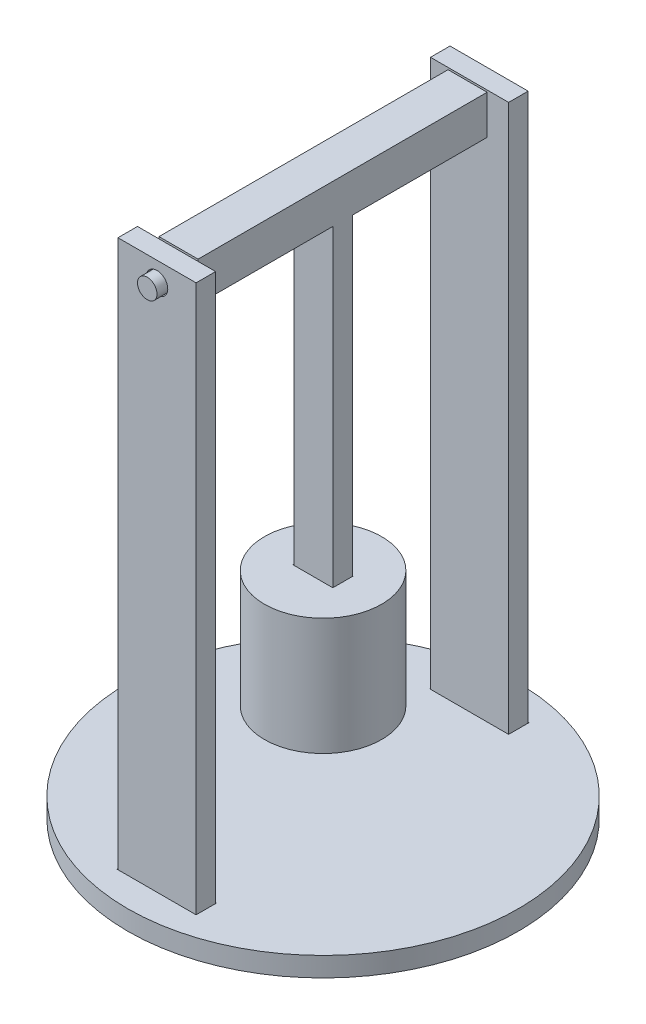
from build123d import *

# Parameters (mm, degrees)
SKETCH1_R               = 50
SKETCH1_W               = 20.2
SKETCH1_H               = 5.2
BOSS_EXTRUDE1_DEPTH     = 5
SKETCH2_W               = 20
SKETCH2_H               = 5
BOSS_EXTRUDE2_DEPTH     = 145
BOSS_EXTRUDE2_2_DEPTH   = 145
CUT_EXTRUDE1_DEPTH      = 162.322658049
CUT_EXTRUDE1_DEPTH_BACK = 162.322658049
SKETCH3_R               = 2.75
SKETCH4_R               = 2.5
BOSS_EXTRUDE3_DEPTH     = 45
SKETCH5_W               = 10
SKETCH5_H               = 10
SKETCH5_R               = 2.5
BOSS_EXTRUDE4_DEPTH     = 37
SKETCH10_W              = 10
SKETCH10_H              = 110
BOSS_EXTRUDE7_DEPTH     = 2.5
SKETCH11_R              = 15
SKETCH11_W              = 10.2
SKETCH11_H              = 5.2
BOSS_EXTRUDE8_DEPTH     = 15


with BuildPart() as part:
    # Sketch1 → Boss-Extrude1 (new body)
    with BuildSketch(Plane(origin=(0, 0, 0), x_dir=(1, 0, 0), z_dir=(0, 1, 0))):
        with Locations(Location((0, 0, 0), (0, 0, 270))):
            Circle(SKETCH1_R)
        with Locations((0, 40)):
            Rectangle(SKETCH1_W, SKETCH1_H, mode=Mode.SUBTRACT)
        with Locations((0, -40)):
            Rectangle(SKETCH1_W, SKETCH1_H, mode=Mode.SUBTRACT)
    extrude(amount=BOSS_EXTRUDE1_DEPTH)


with BuildPart() as body_2:
    # Sketch2 → Boss-Extrude2 (new body)
    with BuildSketch(Plane.XZ):
        with Locations((0, 40)):
            Rectangle(SKETCH2_W, SKETCH2_H)
    extrude(amount=-BOSS_EXTRUDE2_DEPTH)


with BuildPart() as body_3:
    # Sketch2 → Boss-Extrude2 2 (new body)
    with BuildSketch(Plane.XZ):
        with Locations((0, -40)):
            Rectangle(SKETCH2_W, SKETCH2_H)
    extrude(amount=-BOSS_EXTRUDE2_2_DEPTH)


with BuildPart() as cut_extrude1_tool:
    # Sketch3 → Cut-Extrude1 (new, two sides: drawn at the far end of the back side and taken through both)
    with BuildSketch(Plane.XY.offset(-CUT_EXTRUDE1_DEPTH_BACK)):
        with Locations((0, 140)):
            Circle(SKETCH3_R)
    extrude(amount=CUT_EXTRUDE1_DEPTH + CUT_EXTRUDE1_DEPTH_BACK)


with BuildPart() as body_2_1:
    add(body_2.part)

    # Cut-Extrude1: cut by cut_extrude1_tool
    add(cut_extrude1_tool.part, mode=Mode.SUBTRACT)


with BuildPart() as body_3_1:
    add(body_3.part)

    # Cut-Extrude1: cut by cut_extrude1_tool
    add(cut_extrude1_tool.part, mode=Mode.SUBTRACT)


with BuildPart() as body_4:
    # Sketch4 → Boss-Extrude3 (new, symmetric)
    with BuildSketch(Plane.XY):
        with Locations(Location((0, 140, 0), (0, 0, 180))):
            Circle(SKETCH4_R)
    extrude(amount=BOSS_EXTRUDE3_DEPTH, both=True)


with BuildPart() as body_5:
    # Sketch5 → Boss-Extrude4 (new, symmetric)
    with BuildSketch(Plane.XY):
        with Locations((0, 140)):
            Rectangle(SKETCH5_W, SKETCH5_H)
        with Locations((0, 140)):
            Circle(SKETCH5_R, mode=Mode.SUBTRACT)
    extrude(amount=BOSS_EXTRUDE4_DEPTH, both=True)

    # Sketch10 → Boss-Extrude7 (add, symmetric)
    with BuildSketch(Plane.XY):
        with Locations((0, 80)):
            Rectangle(SKETCH10_W, SKETCH10_H)
    extrude(amount=BOSS_EXTRUDE7_DEPTH, both=True)


with BuildPart() as body_6:
    # Sketch11 → Boss-Extrude8 (new, symmetric)
    with BuildSketch(Plane(origin=(0, 40, 0), x_dir=(1, 0, 0), z_dir=(0, 1, 0))):
        with Locations(Location((0, 0, 0), (0, 0, 270))):
            Circle(SKETCH11_R)
        Rectangle(SKETCH11_W, SKETCH11_H, mode=Mode.SUBTRACT)
    extrude(amount=BOSS_EXTRUDE8_DEPTH, both=True)


solid = Compound([part.part, body_2_1.part, body_3_1.part, body_4.part, body_5.part, body_6.part])
